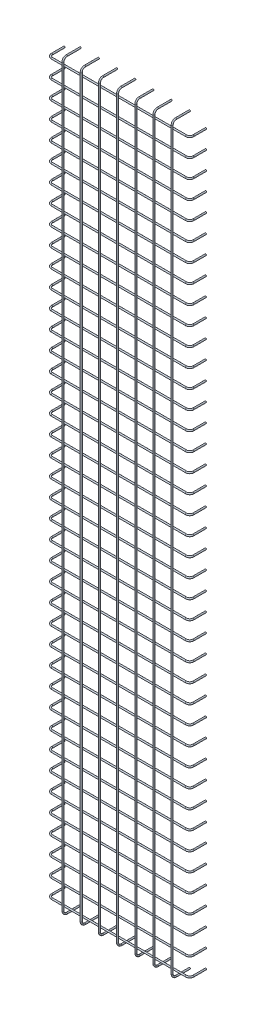
from build123d import *

# Parameters (mm, degrees)
SKETCH_2_R             = 2
PATTERN_LINEAR_2_COUNT = 4
PATTERN_LINEAR_2_PITCH = 50
PATTERN_LINEAR_3_COUNT = 4
PATTERN_LINEAR_3_PITCH = 50
SKETCH_4_R             = 2
PATTERN_LINEAR_4_COUNT = 21
PATTERN_LINEAR_4_PITCH = 50
PATTERN_LINEAR_5_COUNT = 21
PATTERN_LINEAR_5_PITCH = 50


with BuildPart() as part:
    # По траектории1: sweep along a path in Эскиз1
    with BuildLine(Plane(origin=(0, 0, 0), x_dir=(0, 0, -1), z_dir=(1, 0, 0))) as sweep_1_path:
        Line((50, 1020.5), (12, 1020.5))
        ThreePointArc((12, 1020.5), (4.928932188, 1017.571067812), (2, 1010.5))
        Line((2, 1010.5), (2, -1010.5))
        ThreePointArc((2, -1010.5), (4.928932188, -1017.571067812), (12, -1020.5))
        Line((12, -1020.5), (50, -1020.5))
    # Эскиз2 → По траектории1 (sweep)
    with BuildSketch(Plane(origin=(0, 0, -50), x_dir=(-1, 0, 0), z_dir=(0, 0, -1))):
        with Locations((0, -1020.5)):
            Circle(SKETCH_2_R)
    sweep(path=sweep_1_path.line)


with BuildPart() as pattern_linear_2_1:
    # Линейный массив2: pattern copy
    add(part.part.moved(Location(Vector(-1, 0, 0) * (1 * PATTERN_LINEAR_2_PITCH))))


with BuildPart() as pattern_linear_2_2:
    # Линейный массив2: pattern copy
    add(part.part.moved(Location(Vector(-1, 0, 0) * (2 * PATTERN_LINEAR_2_PITCH))))


with BuildPart() as pattern_linear_2_3:
    # Линейный массив2: pattern copy
    add(part.part.moved(Location(Vector(-1, 0, 0) * (3 * PATTERN_LINEAR_2_PITCH))))


with BuildPart() as pattern_linear_3_1:
    # Линейный массив3: pattern copy
    add(part.part.moved(Location(Vector(1, 0, 0) * (1 * PATTERN_LINEAR_3_PITCH))))


with BuildPart() as pattern_linear_3_2:
    # Линейный массив3: pattern copy
    add(part.part.moved(Location(Vector(1, 0, 0) * (2 * PATTERN_LINEAR_3_PITCH))))


with BuildPart() as pattern_linear_3_3:
    # Линейный массив3: pattern copy
    add(part.part.moved(Location(Vector(1, 0, 0) * (3 * PATTERN_LINEAR_3_PITCH))))


with BuildPart() as body_8:
    # По траектории2: sweep along a path in Эскиз3
    with BuildLine(Plane(origin=(0, 0, 0), x_dir=(1, 0, 0), z_dir=(0, 1, 0))) as sweep_2_path:
        Line((-194.25, 50), (-194.25, 16))
        ThreePointArc((-194.25, 16), (-191.321067812, 8.928932188), (-184.25, 6))
        Line((-184.25, 6), (184.25, 6))
        ThreePointArc((184.25, 6), (191.321067812, 8.928932188), (194.25, 16))
        Line((194.25, 16), (194.25, 50))
    # Эскиз4 → По траектории2 (sweep)
    with BuildSketch(Plane(origin=(0, 0, -50), x_dir=(-1, 0, 0), z_dir=(0, 0, -1))):
        with Locations((-194.25, 0)):
            Circle(SKETCH_4_R)
    sweep(path=sweep_2_path.line)


with BuildPart() as pattern_linear_4_1:
    # Линейный массив4: pattern copy
    add(body_8.part.moved(Location(Vector(0, 1, 0) * (1 * PATTERN_LINEAR_4_PITCH))))


with BuildPart() as pattern_linear_4_2:
    # Линейный массив4: pattern copy
    add(body_8.part.moved(Location(Vector(0, 1, 0) * (2 * PATTERN_LINEAR_4_PITCH))))


with BuildPart() as pattern_linear_4_3:
    # Линейный массив4: pattern copy
    add(body_8.part.moved(Location(Vector(0, 1, 0) * (3 * PATTERN_LINEAR_4_PITCH))))


with BuildPart() as pattern_linear_4_4:
    # Линейный массив4: pattern copy
    add(body_8.part.moved(Location(Vector(0, 1, 0) * (4 * PATTERN_LINEAR_4_PITCH))))


with BuildPart() as pattern_linear_4_5:
    # Линейный массив4: pattern copy
    add(body_8.part.moved(Location(Vector(0, 1, 0) * (5 * PATTERN_LINEAR_4_PITCH))))


with BuildPart() as pattern_linear_4_6:
    # Линейный массив4: pattern copy
    add(body_8.part.moved(Location(Vector(0, 1, 0) * (6 * PATTERN_LINEAR_4_PITCH))))


with BuildPart() as pattern_linear_4_7:
    # Линейный массив4: pattern copy
    add(body_8.part.moved(Location(Vector(0, 1, 0) * (7 * PATTERN_LINEAR_4_PITCH))))


with BuildPart() as pattern_linear_4_8:
    # Линейный массив4: pattern copy
    add(body_8.part.moved(Location(Vector(0, 1, 0) * (8 * PATTERN_LINEAR_4_PITCH))))


with BuildPart() as pattern_linear_4_9:
    # Линейный массив4: pattern copy
    add(body_8.part.moved(Location(Vector(0, 1, 0) * (9 * PATTERN_LINEAR_4_PITCH))))


with BuildPart() as pattern_linear_4_10:
    # Линейный массив4: pattern copy
    add(body_8.part.moved(Location(Vector(0, 1, 0) * (10 * PATTERN_LINEAR_4_PITCH))))


with BuildPart() as pattern_linear_4_11:
    # Линейный массив4: pattern copy
    add(body_8.part.moved(Location(Vector(0, 1, 0) * (11 * PATTERN_LINEAR_4_PITCH))))


with BuildPart() as pattern_linear_4_12:
    # Линейный массив4: pattern copy
    add(body_8.part.moved(Location(Vector(0, 1, 0) * (12 * PATTERN_LINEAR_4_PITCH))))


with BuildPart() as pattern_linear_4_13:
    # Линейный массив4: pattern copy
    add(body_8.part.moved(Location(Vector(0, 1, 0) * (13 * PATTERN_LINEAR_4_PITCH))))


with BuildPart() as pattern_linear_4_14:
    # Линейный массив4: pattern copy
    add(body_8.part.moved(Location(Vector(0, 1, 0) * (14 * PATTERN_LINEAR_4_PITCH))))


with BuildPart() as pattern_linear_4_15:
    # Линейный массив4: pattern copy
    add(body_8.part.moved(Location(Vector(0, 1, 0) * (15 * PATTERN_LINEAR_4_PITCH))))


with BuildPart() as pattern_linear_4_16:
    # Линейный массив4: pattern copy
    add(body_8.part.moved(Location(Vector(0, 1, 0) * (16 * PATTERN_LINEAR_4_PITCH))))


with BuildPart() as pattern_linear_4_17:
    # Линейный массив4: pattern copy
    add(body_8.part.moved(Location(Vector(0, 1, 0) * (17 * PATTERN_LINEAR_4_PITCH))))


with BuildPart() as pattern_linear_4_18:
    # Линейный массив4: pattern copy
    add(body_8.part.moved(Location(Vector(0, 1, 0) * (18 * PATTERN_LINEAR_4_PITCH))))


with BuildPart() as pattern_linear_4_19:
    # Линейный массив4: pattern copy
    add(body_8.part.moved(Location(Vector(0, 1, 0) * (19 * PATTERN_LINEAR_4_PITCH))))


with BuildPart() as pattern_linear_4_20:
    # Линейный массив4: pattern copy
    add(body_8.part.moved(Location(Vector(0, 1, 0) * (20 * PATTERN_LINEAR_4_PITCH))))


with BuildPart() as pattern_linear_5_1:
    # Линейный массив5: pattern copy
    add(body_8.part.moved(Location(Vector(0, -1, 0) * (1 * PATTERN_LINEAR_5_PITCH))))


with BuildPart() as pattern_linear_5_2:
    # Линейный массив5: pattern copy
    add(body_8.part.moved(Location(Vector(0, -1, 0) * (2 * PATTERN_LINEAR_5_PITCH))))


with BuildPart() as pattern_linear_5_3:
    # Линейный массив5: pattern copy
    add(body_8.part.moved(Location(Vector(0, -1, 0) * (3 * PATTERN_LINEAR_5_PITCH))))


with BuildPart() as pattern_linear_5_4:
    # Линейный массив5: pattern copy
    add(body_8.part.moved(Location(Vector(0, -1, 0) * (4 * PATTERN_LINEAR_5_PITCH))))


with BuildPart() as pattern_linear_5_5:
    # Линейный массив5: pattern copy
    add(body_8.part.moved(Location(Vector(0, -1, 0) * (5 * PATTERN_LINEAR_5_PITCH))))


with BuildPart() as pattern_linear_5_6:
    # Линейный массив5: pattern copy
    add(body_8.part.moved(Location(Vector(0, -1, 0) * (6 * PATTERN_LINEAR_5_PITCH))))


with BuildPart() as pattern_linear_5_7:
    # Линейный массив5: pattern copy
    add(body_8.part.moved(Location(Vector(0, -1, 0) * (7 * PATTERN_LINEAR_5_PITCH))))


with BuildPart() as pattern_linear_5_8:
    # Линейный массив5: pattern copy
    add(body_8.part.moved(Location(Vector(0, -1, 0) * (8 * PATTERN_LINEAR_5_PITCH))))


with BuildPart() as pattern_linear_5_9:
    # Линейный массив5: pattern copy
    add(body_8.part.moved(Location(Vector(0, -1, 0) * (9 * PATTERN_LINEAR_5_PITCH))))


with BuildPart() as pattern_linear_5_10:
    # Линейный массив5: pattern copy
    add(body_8.part.moved(Location(Vector(0, -1, 0) * (10 * PATTERN_LINEAR_5_PITCH))))


with BuildPart() as pattern_linear_5_11:
    # Линейный массив5: pattern copy
    add(body_8.part.moved(Location(Vector(0, -1, 0) * (11 * PATTERN_LINEAR_5_PITCH))))


with BuildPart() as pattern_linear_5_12:
    # Линейный массив5: pattern copy
    add(body_8.part.moved(Location(Vector(0, -1, 0) * (12 * PATTERN_LINEAR_5_PITCH))))


with BuildPart() as pattern_linear_5_13:
    # Линейный массив5: pattern copy
    add(body_8.part.moved(Location(Vector(0, -1, 0) * (13 * PATTERN_LINEAR_5_PITCH))))


with BuildPart() as pattern_linear_5_14:
    # Линейный массив5: pattern copy
    add(body_8.part.moved(Location(Vector(0, -1, 0) * (14 * PATTERN_LINEAR_5_PITCH))))


with BuildPart() as pattern_linear_5_15:
    # Линейный массив5: pattern copy
    add(body_8.part.moved(Location(Vector(0, -1, 0) * (15 * PATTERN_LINEAR_5_PITCH))))


with BuildPart() as pattern_linear_5_16:
    # Линейный массив5: pattern copy
    add(body_8.part.moved(Location(Vector(0, -1, 0) * (16 * PATTERN_LINEAR_5_PITCH))))


with BuildPart() as pattern_linear_5_17:
    # Линейный массив5: pattern copy
    add(body_8.part.moved(Location(Vector(0, -1, 0) * (17 * PATTERN_LINEAR_5_PITCH))))


with BuildPart() as pattern_linear_5_18:
    # Линейный массив5: pattern copy
    add(body_8.part.moved(Location(Vector(0, -1, 0) * (18 * PATTERN_LINEAR_5_PITCH))))


with BuildPart() as pattern_linear_5_19:
    # Линейный массив5: pattern copy
    add(body_8.part.moved(Location(Vector(0, -1, 0) * (19 * PATTERN_LINEAR_5_PITCH))))


with BuildPart() as pattern_linear_5_20:
    # Линейный массив5: pattern copy
    add(body_8.part.moved(Location(Vector(0, -1, 0) * (20 * PATTERN_LINEAR_5_PITCH))))


solid = Compound([part.part, pattern_linear_2_1.part, pattern_linear_2_2.part, pattern_linear_2_3.part, pattern_linear_3_1.part, pattern_linear_3_2.part, pattern_linear_3_3.part, body_8.part, pattern_linear_4_1.part, pattern_linear_4_2.part, pattern_linear_4_3.part, pattern_linear_4_4.part, pattern_linear_4_5.part, pattern_linear_4_6.part, pattern_linear_4_7.part, pattern_linear_4_8.part, pattern_linear_4_9.part, pattern_linear_4_10.part, pattern_linear_4_11.part, pattern_linear_4_12.part, pattern_linear_4_13.part, pattern_linear_4_14.part, pattern_linear_4_15.part, pattern_linear_4_16.part, pattern_linear_4_17.part, pattern_linear_4_18.part, pattern_linear_4_19.part, pattern_linear_4_20.part, pattern_linear_5_1.part, pattern_linear_5_2.part, pattern_linear_5_3.part, pattern_linear_5_4.part, pattern_linear_5_5.part, pattern_linear_5_6.part, pattern_linear_5_7.part, pattern_linear_5_8.part, pattern_linear_5_9.part, pattern_linear_5_10.part, pattern_linear_5_11.part, pattern_linear_5_12.part, pattern_linear_5_13.part, pattern_linear_5_14.part, pattern_linear_5_15.part, pattern_linear_5_16.part, pattern_linear_5_17.part, pattern_linear_5_18.part, pattern_linear_5_19.part, pattern_linear_5_20.part])
